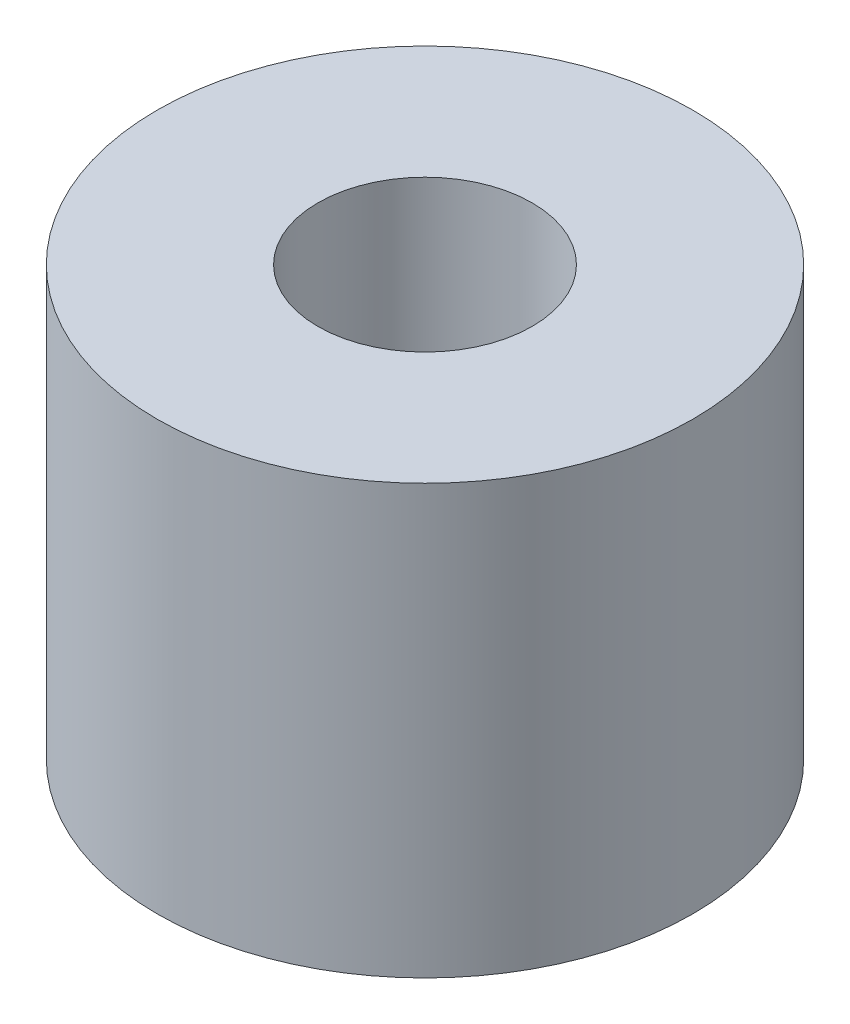
from build123d import *

# Parameters (mm, degrees)
SKETCH_1_R      = 5
SKETCH_1_R_2    = 2
EXTRUDE_1_DEPTH = 8


with BuildPart() as part:
    # Эскиз1 → Бобышка-Вытянуть1 (new body)
    with BuildSketch(Plane(origin=(0, 0, 0), x_dir=(1, 0, 0), z_dir=(0, 1, 0))):
        with Locations(Location((0, 0, 0), (0, 0, 270))):
            Circle(SKETCH_1_R)
        with Locations(Location((0, 0, 0), (0, 0, 270))):
            Circle(SKETCH_1_R_2, mode=Mode.SUBTRACT)
    extrude(amount=EXTRUDE_1_DEPTH)


solid = part.part
